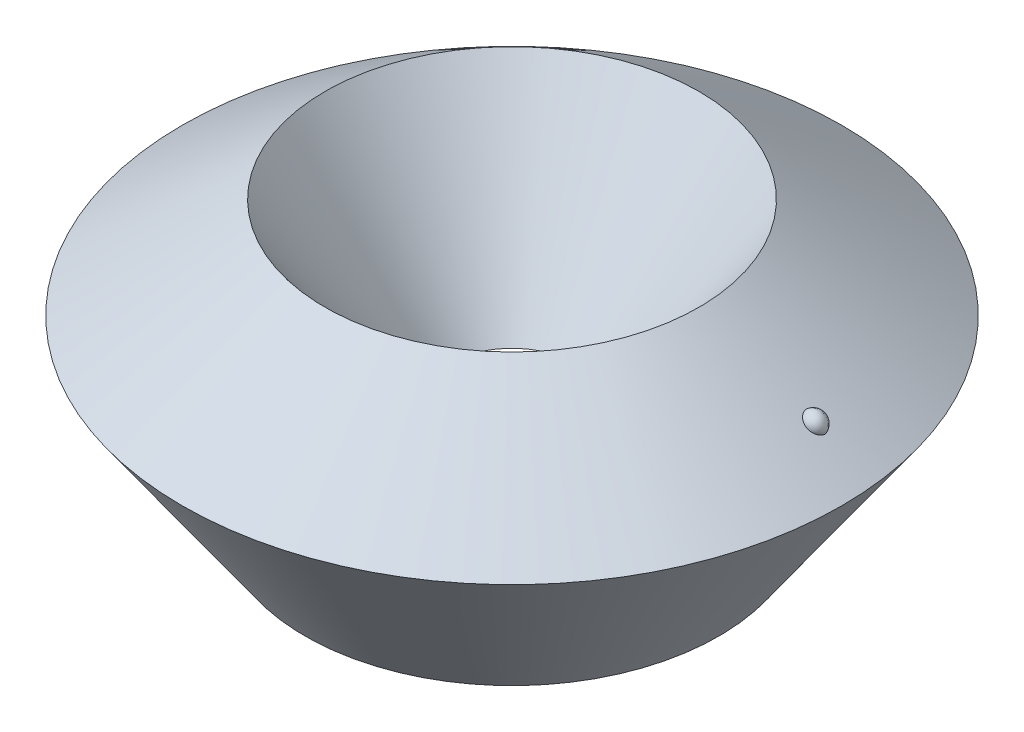
from build123d import *


with BuildPart() as part:
    # Sketch1 → Revolve1 (revolve)
    with BuildSketch(Plane.XY, mode=Mode.PRIVATE) as revolve1_sk:
        Polygon((-692.981724201, -274.163233074), (-1104.570765124, 309.874222783), (-626.447108873, 646.822572835), (-214.85806795, 62.785116977), align=None)
    revolve(revolve1_sk.sketch.rotate(Axis((0, 0, 0), (0, 1, 0)), 270), axis=Axis((0, 0, 0), (0, 1, 0)))

    # Sketch3 → Revolve2 (revolve)
    with BuildSketch(Plane(origin=(0, 0, 0), x_dir=(0.9961946980917455, 0, -0.08715574274765836), z_dir=(0.08715574274765836, 0, 0.9961946980917455))):
        with BuildLine():
            Line((968.545287148, 405.735533492), (907.129740627, 449.016945732))
            ThreePointArc((907.129740627, 449.016945732), (956.12724874, 453.329044836), (968.545287148, 405.735533492))
        make_face()
    revolve(axis=Axis((624.063288494, 646.822572835, -54.598463066), (0.8143006918189212, -0.5760546410275964, -0.0712420792354729)))


solid = part.part
